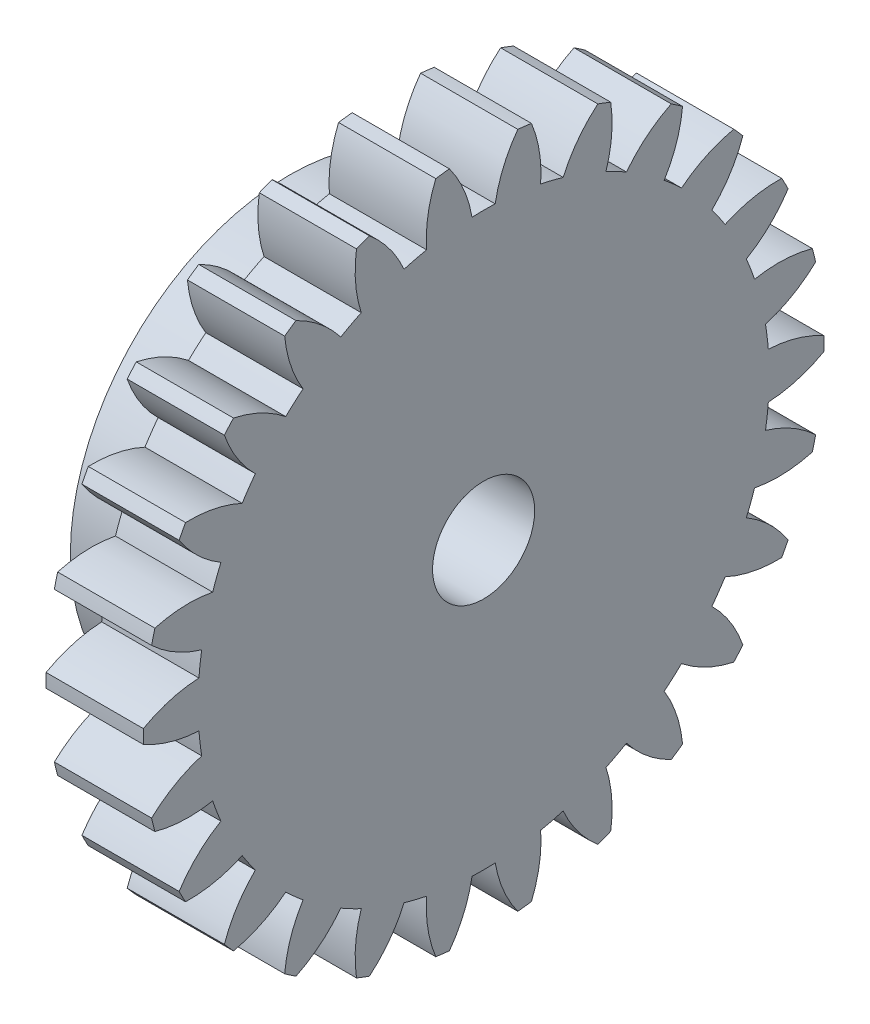
from build123d import *

# Parameters (mm, degrees)
BASPROSKE_W         = 4
BASPROSKE_H         = 14
TOOTHCUT_DEPTH      = 21.199009877
TEETHCUTS_COUNT     = 26
TEETHCUTS_ANGLE     = 346.153846154
BORSKE_R            = 2
BORE_DEPTH          = 50.0000508
SKETCH_1_R          = 9
SKETCH_1_R_2        = 2
EXTRUDE_1_DEPTH     = 4
CUT_EXTRUDE_1_DEPTH = 3
SKETCH_4_R          = 2.1
CUT_EXTRUDE_2_DEPTH = 22.307778916


with BuildPart() as part:
    # BasProSke → Base-Revolve (revolve)
    with BuildSketch(Plane(origin=(0, 0, 0), x_dir=(1, 0, 0), z_dir=(0, 1, 0)), mode=Mode.PRIVATE) as base_revolve_sk:
        with Locations((2, 7)):
            Rectangle(BASPROSKE_W, BASPROSKE_H)
    revolve(base_revolve_sk.sketch.rotate(Axis((-10, 0, 0), (1, 0, 0)), 180), axis=Axis((-10, 0, 0), (1, 0, 0)))

    # TooCutSke → ToothCut (cut, through all)
    with BuildSketch(Plane(origin=(0, 0, 0), x_dir=(0, 0, -1), z_dir=(1, 0, 0))):
        with BuildLine():
            ThreePointArc((0.476965065, 11.739314517), (0, 11.749), (-0.476965065, 11.739314517))
            ThreePointArc((-0.476965065, 11.739314517), (-0.82065865, 12.901686978), (-1.424117301, 13.952911348))
            ThreePointArc((-1.424117301, 13.952911348), (0, 14.0254), (1.424117301, 13.952911348))
            ThreePointArc((1.424117301, 13.952911348), (0.82065865, 12.901686978), (0.476965065, 11.739314517))
        make_face()
    toothcut = extrude(amount=TOOTHCUT_DEPTH, mode=Mode.SUBTRACT)

    # TeethCuts: ToothCut ×26 about axis
    teethcuts_axis = Axis((-10, 0, 0), (1, 0, 0))
    for i in range(1, TEETHCUTS_COUNT):
        add(toothcut.rotate(teethcuts_axis, i * TEETHCUTS_ANGLE / (TEETHCUTS_COUNT - 1)), mode=Mode.SUBTRACT)

    # BorSke → Bore (cut, symmetric)
    with BuildSketch(Plane(origin=(0, 0, 0), x_dir=(0, 0, -1), z_dir=(1, 0, 0))):
        with Locations(Location((0, 0, 0), (0, 0, 180))):
            Circle(BORSKE_R)
    extrude(amount=BORE_DEPTH, both=True, mode=Mode.SUBTRACT)

    # 草图1 → 凸台-拉伸1 (add)
    with BuildSketch(Plane.ZY):
        with Locations(Location((0, 0, 0), (0, 0, 180))):
            Circle(SKETCH_1_R)
        Circle(SKETCH_1_R_2, mode=Mode.SUBTRACT)
    extrude(amount=EXTRUDE_1_DEPTH)

    # 草图2 → 切除-拉伸1 (cut)
    with BuildSketch(Plane.ZY.offset(4)):
        Polygon((6.2, 3.579571669), (0, 7.159143338), (-6.2, 3.579571669), (-6.2, -3.579571669), (0, -7.159143338), (6.2, -3.579571669), align=None)
    extrude(amount=-CUT_EXTRUDE_1_DEPTH, mode=Mode.SUBTRACT)

    # 草图4 → 切除-拉伸2 (cut, through all)
    with BuildSketch(Plane(origin=(4, 0, 0), x_dir=(0, 0, -1), z_dir=(1, 0, 0))):
        Circle(SKETCH_4_R)
    extrude(amount=-CUT_EXTRUDE_2_DEPTH, mode=Mode.SUBTRACT)


solid = part.part
